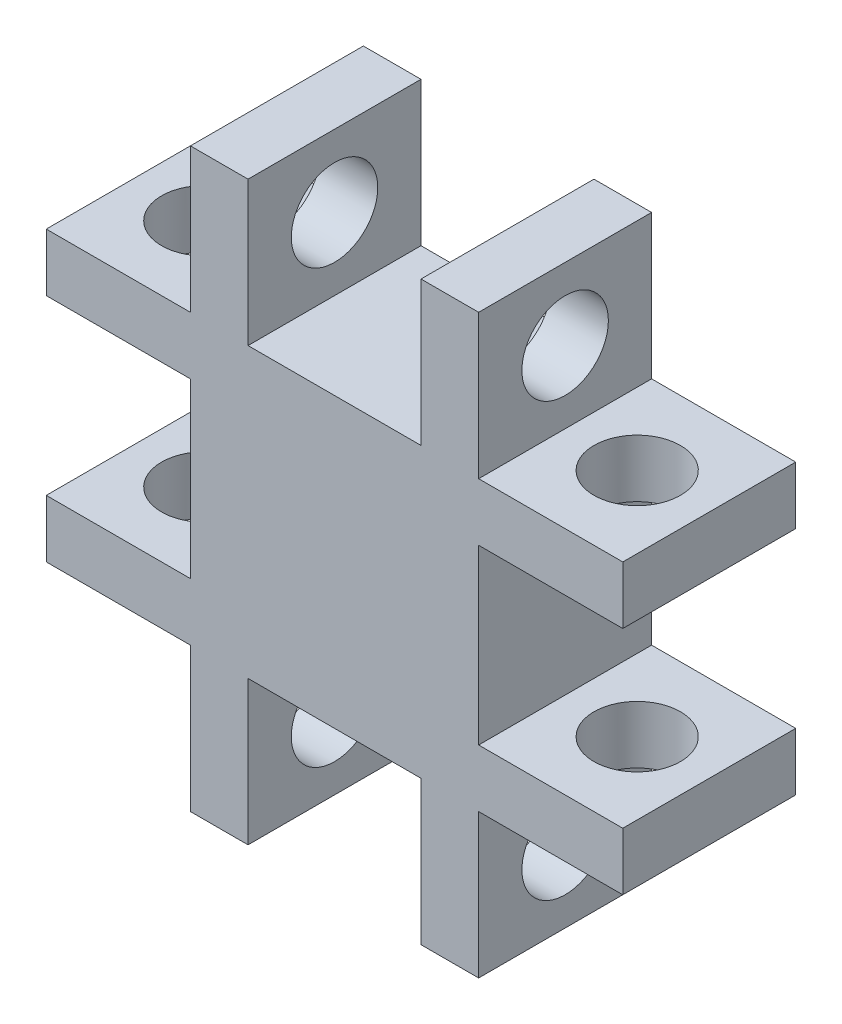
from build123d import *

# Parameters (mm, degrees)
SKETCH1_W           = 100
SKETCH1_H           = 100
BOSS_EXTRUDE1_DEPTH = 60
SKETCH2_W           = 60
SKETCH2_H           = 20
BOSS_EXTRUDE2_DEPTH = 50
SKETCH3_W           = 20
SKETCH3_H           = 60
BOSS_EXTRUDE3_DEPTH = 50
SKETCH4_R           = 15
CUT_EXTRUDE1_DEPTH  = 100
SKETCH5_R           = 15
CUT_EXTRUDE2_DEPTH  = 100


with BuildPart() as part:
    # Sketch1 → Boss-Extrude1 (new body)
    with BuildSketch(Plane.XY):
        Rectangle(SKETCH1_W, SKETCH1_H)
    extrude(amount=BOSS_EXTRUDE1_DEPTH)

    # Sketch2 → Boss-Extrude2 (add)
    with BuildSketch(Plane(origin=(50, 0, 0), x_dir=(0, 0, -1), z_dir=(1, 0, 0))):
        with Locations((-30, 40)):
            Rectangle(SKETCH2_W, SKETCH2_H)
        with Locations((-30, -40)):
            Rectangle(SKETCH2_W, SKETCH2_H)
    boss_extrude2 = extrude(amount=BOSS_EXTRUDE2_DEPTH)

    # Sketch3 → Boss-Extrude3 (add)
    with BuildSketch(Plane.XZ.offset(50)):
        with Locations((-40, 30)):
            Rectangle(SKETCH3_W, SKETCH3_H)
        with Locations((40, 30)):
            Rectangle(SKETCH3_W, SKETCH3_H)
    boss_extrude3 = extrude(amount=BOSS_EXTRUDE3_DEPTH)

    # Sketch4 → Cut-Extrude1 (cut)
    with BuildSketch(Plane.XZ.offset(50)):
        with Locations(Location((75, 30, 0), (0, 0, 270))):
            Circle(SKETCH4_R)
    cut_extrude1 = extrude(amount=-CUT_EXTRUDE1_DEPTH, mode=Mode.SUBTRACT)

    # Sketch5 → Cut-Extrude2 (cut)
    with BuildSketch(Plane(origin=(50, 0, 0), x_dir=(0, 0, -1), z_dir=(1, 0, 0))):
        with Locations((-30, -75)):
            Circle(SKETCH5_R)
    cut_extrude2 = extrude(amount=-CUT_EXTRUDE2_DEPTH, mode=Mode.SUBTRACT)

    # Mirror2: Boss-Extrude2, Cut-Extrude1 across plane
    add(boss_extrude2.mirror(Plane(origin=(0, 0, 0), x_dir=(0, 0, 1), z_dir=(1, 0, 0))))
    add(cut_extrude1.mirror(Plane(origin=(0, 0, 0), x_dir=(0, 0, 1), z_dir=(1, 0, 0))), mode=Mode.SUBTRACT)

    # Mirror3: Boss-Extrude3, Cut-Extrude2 across plane
    add(boss_extrude3.mirror(Plane.ZX))
    add(cut_extrude2.mirror(Plane.ZX), mode=Mode.SUBTRACT)


solid = part.part
